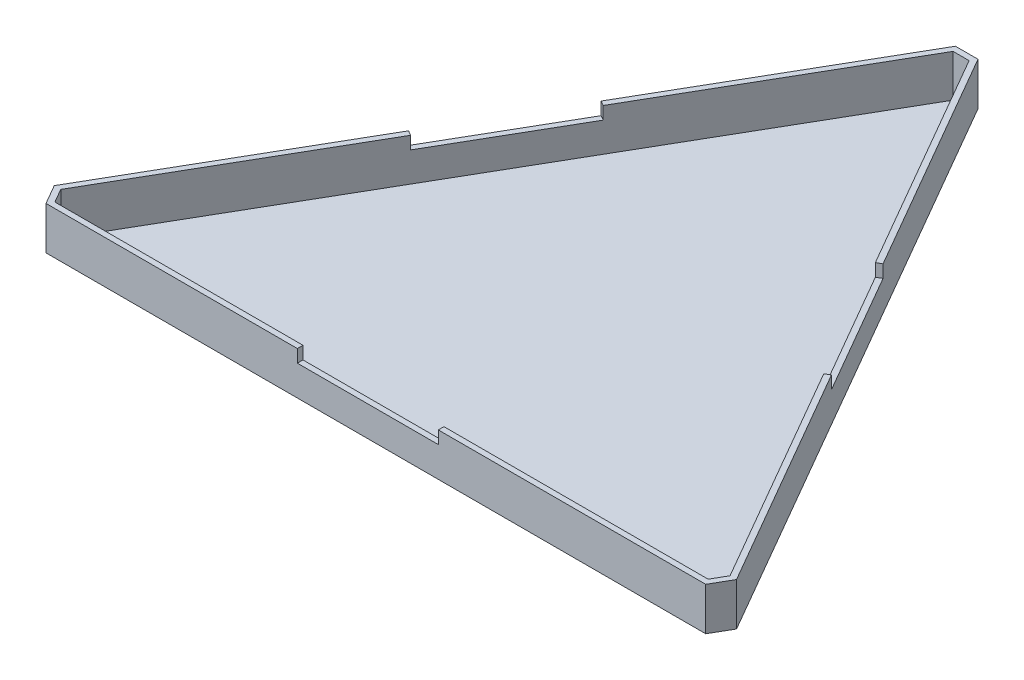
from build123d import *

# Parameters (mm, degrees)
BOSS_EXTRUDE6_DEPTH = 0.2
BOSS_EXTRUDE8_DEPTH = 15.2
SKETCH2_W           = 50
SKETCH2_H           = 9
CUT_EXTRUDE1_DEPTH  = 2
SKETCH3_W           = 50
SKETCH3_H           = 9
CUT_EXTRUDE2_DEPTH  = 2
SKETCH4_W           = 50
SKETCH4_H           = 9
CUT_EXTRUDE3_DEPTH  = 2


with BuildPart() as part:
    # Sketch1 → Boss-Extrude6 (new body)
    with BuildSketch(Plane(origin=(0, 0, 0), x_dir=(1, 0, 0), z_dir=(0, 1, 0))):
        Polygon((351.272917769, 67.665499075), (468.273000096, -134.984588004), (464.273241085, -141.912373829), (230.273290915, -141.912373829), (226.272682949, -134.984246141), (343.272757546, 67.665499075), align=None)
    extrude(amount=BOSS_EXTRUDE6_DEPTH)

    # Sketch1<7> → Boss-Extrude8 (add)
    with BuildSketch(Plane(origin=(0, 0, 0), x_dir=(1, 0, 0), z_dir=(0, 1, 0))):
        Polygon((351.272917769, 67.665499075), (468.273000096, -134.984588004), (464.273241085, -141.912373829), (230.273290915, -141.912373829), (226.272682949, -134.984246141), (343.272757546, 67.665499075), align=None)
        Polygon((231.427991453, -139.912373829), (463.118576698, -139.912436444), (465.963671321, -134.984588004), (350.118252434, 65.665563332), (344.427420986, 65.665563332), (228.58200795, -134.984248572), align=None, mode=Mode.SUBTRACT)
    extrude(amount=BOSS_EXTRUDE8_DEPTH)

    # Sketch2 → Cut-Extrude1 (cut)
    with BuildSketch(Plane.XY.offset(141.912373829)):
        with Locations((344.427420986, 15.2)):
            Rectangle(SKETCH2_W, SKETCH2_H)
    extrude(amount=-CUT_EXTRUDE1_DEPTH, mode=Mode.SUBTRACT)

    # Sketch3 → Cut-Extrude2 (cut)
    with BuildSketch(Plane(origin=(292.754708906, 0, -169.022009994), x_dir=(-0.5000000000000001, 0, -0.8660254037844386), z_dir=(0.8660254037844386, 0, -0.5000000000000001))):
        with Locations((-234.036500052, 15.2)):
            Rectangle(SKETCH3_W, SKETCH3_H)
    extrude(amount=-CUT_EXTRUDE2_DEPTH, mode=Mode.SUBTRACT)

    # Sketch4 → Cut-Extrude3 (cut)
    with BuildSketch(Plane(origin=(228.154315179, 0, 131.7251688), x_dir=(-0.5000006078406093, 0, 0.866025052847215), z_dir=(-0.866025052847215, 0, -0.5000006078406093))):
        with Locations((-113.236672478, 15.2)):
            Rectangle(SKETCH4_W, SKETCH4_H)
    extrude(amount=-CUT_EXTRUDE3_DEPTH, mode=Mode.SUBTRACT)


solid = part.part
